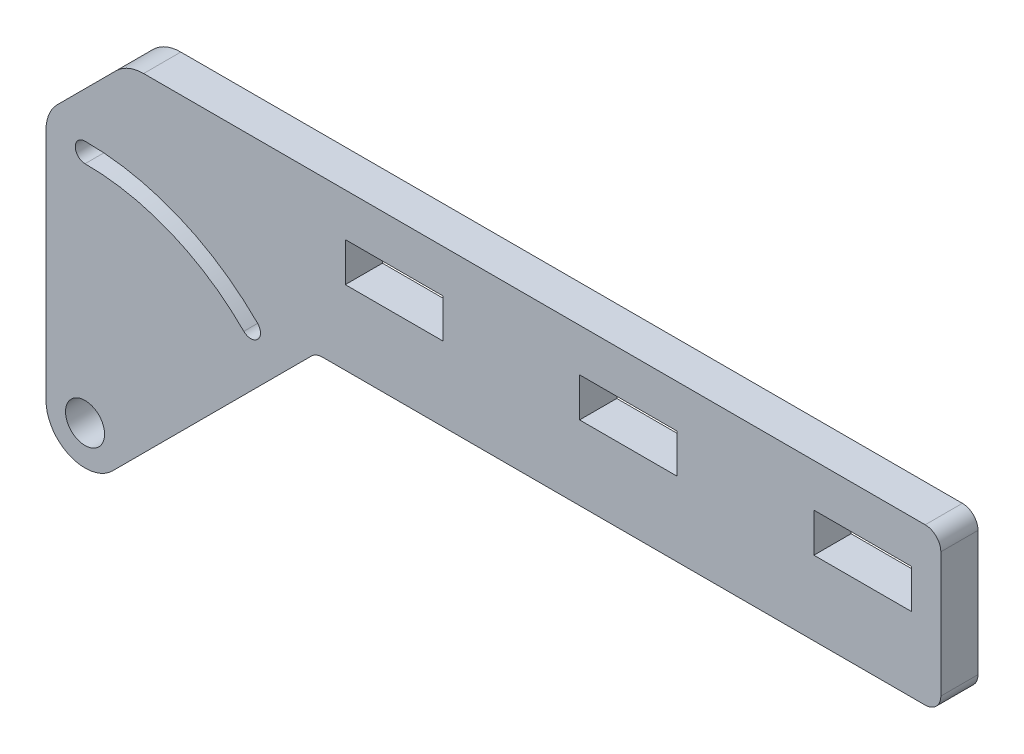
from build123d import *

# Parameters (mm, degrees)
SKETCH1_R           = 3.175
BOSS_EXTRUDE1_DEPTH = 6.0452
SKETCH2_W           = 15.875
SKETCH2_H           = 6.35
CUT_EXTRUDE1_DEPTH  = 6.0452


with BuildPart() as part:
    # Sketch1 → Boss-Extrude1 (new body)
    with BuildSketch(Plane.XY):
        with BuildLine():
            Line((-6.35, 38.1), (-6.35, 0))
            ThreePointArc((-6.35, 0), (-2.430039796, -5.866635031), (4.490128061, -4.490128061))
            Line((4.490128061, -4.490128061), (31.430896424, 22.450640303))
            Line((31.430896424, 22.450640303), (36.811307345, 27.831051224))
            ThreePointArc((36.811307345, 27.831051224), (37.635342651, 28.381654013), (38.607358569, 28.575))
            Line((38.607358569, 28.575), (136.615256121, 28.575))
            ThreePointArc((136.615256121, 28.575), (138.411307345, 29.318948776), (139.155256121, 31.115))
            Line((139.155256121, 31.115), (139.155256121, 51.435))
            ThreePointArc((139.155256121, 51.435), (138.411307345, 53.231051224), (136.615256121, 53.975))
            Line((136.615256121, 53.975), (9.525, 53.975))
            ThreePointArc((9.525, 53.975), (7.094960204, 53.491635031), (5.034871939, 52.115128061))
            Line((5.034871939, 52.115128061), (-4.490128061, 42.590128061))
            ThreePointArc((-4.490128061, 42.590128061), (-5.866635031, 40.530039796), (-6.35, 38.1))
        make_face()
        Circle(SKETCH1_R, mode=Mode.SUBTRACT)
        with BuildLine():
            ThreePointArc((25.818236348, 25.818236348), (13.972728824, 33.733151431), (0, 36.5125))
            ThreePointArc((0, 36.5125), (-1.5875, 38.1), (0, 39.6875))
            ThreePointArc((0, 39.6875), (15.187748722, 36.666468947), (28.063300378, 28.063300378))
            ThreePointArc((28.063300378, 28.063300378), (28.063300378, 25.818236348), (25.818236348, 25.818236348))
        make_face(mode=Mode.SUBTRACT)
    extrude(amount=BOSS_EXTRUDE1_DEPTH)

    # Sketch2 → Cut-Extrude1 (cut)
    with BuildSketch(Plane.XY.offset(6.0452)):
        with Locations((126.455256121, 43.815)):
            Rectangle(SKETCH2_W, SKETCH2_H)
        with Locations((88.355256121, 43.815)):
            Rectangle(SKETCH2_W, SKETCH2_H)
        with Locations((50.255256121, 43.815)):
            Rectangle(SKETCH2_W, SKETCH2_H)
    extrude(amount=-CUT_EXTRUDE1_DEPTH, mode=Mode.SUBTRACT)


solid = part.part
